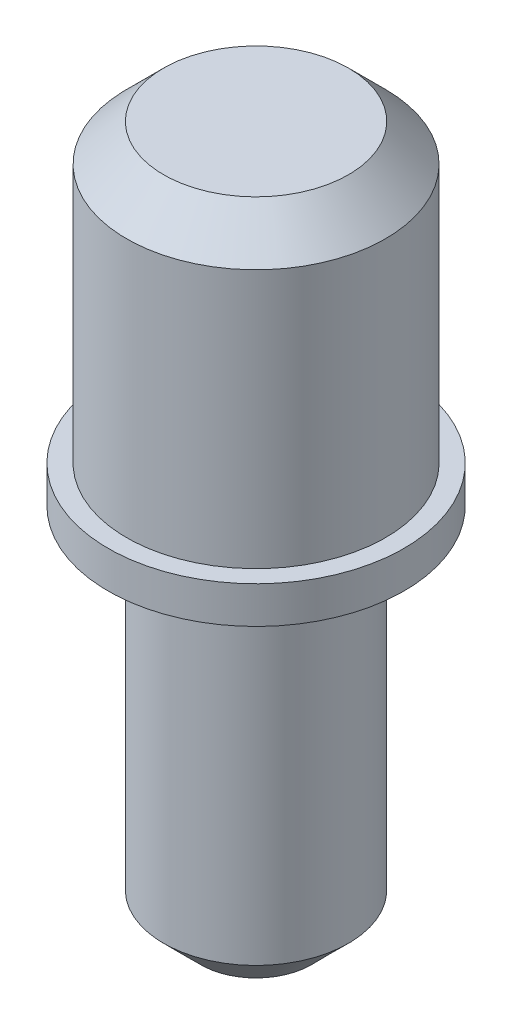
from build123d import *


with BuildPart() as part:
    # 草图1 → 旋转1 (revolve)
    with BuildSketch(Plane.XY, mode=Mode.PRIVATE) as revolve_1_sk:
        Polygon((0, 0), (0, 19), (2.5, 19), (3.5, 18), (3.5, 11), (4, 11), (4, 10), (2.5, 10), (2.5, 1), (1.5, 0), align=None)
    revolve(revolve_1_sk.sketch.rotate(Axis((0, 0, 0), (0, 1, 0)), 90), axis=Axis((0, 0, 0), (0, 1, 0)))


solid = part.part
